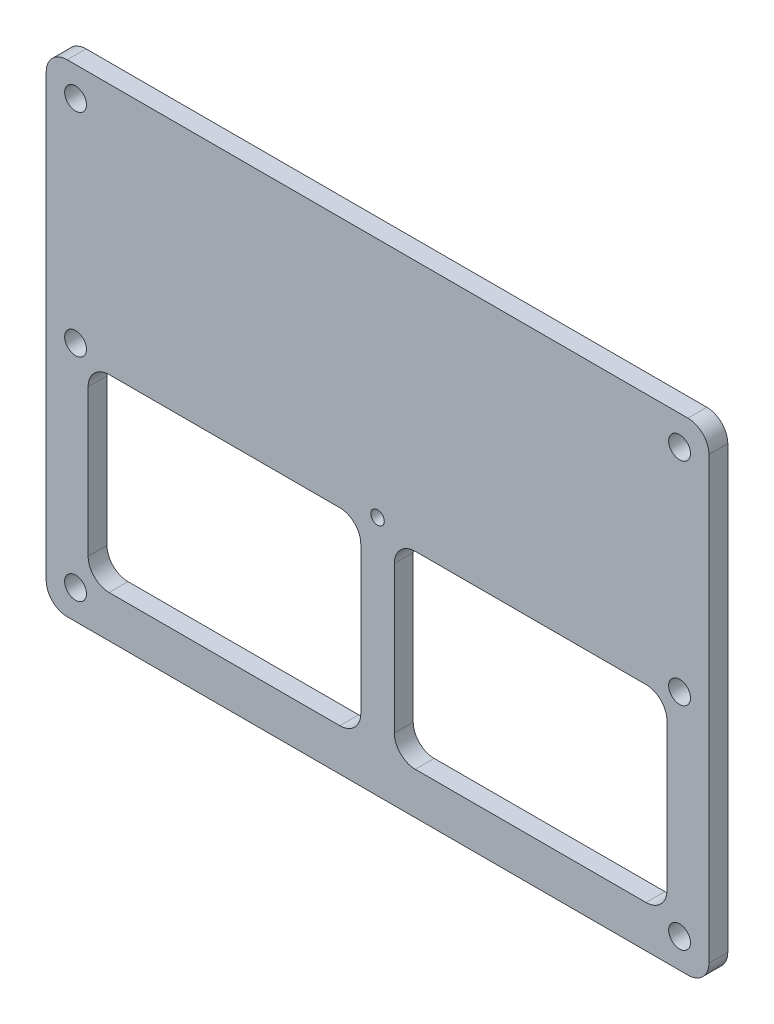
from build123d import *

# Parameters (mm, degrees)
SKETCH_1_W          = 158
SKETCH_1_H          = 115
EXTRUDE_1_DEPTH     = 4.5
SKETCH_2_R          = 2.6
SKETCH_2_R_2        = 1.6
CUT_EXTRUDE_1_DEPTH = 4.5
FILLET_1_R          = 5


with BuildPart() as part:
    # 草图1 → 凸台-拉伸1 (new body)
    with BuildSketch(Plane.XY):
        Rectangle(SKETCH_1_W, SKETCH_1_H)
    extrude(amount=EXTRUDE_1_DEPTH)

    # 草图2 → 切除-拉伸1 (cut)
    with BuildSketch(Plane.XY.offset(4.5)):
        with Locations((-72, 50.5)):
            Circle(SKETCH_2_R)
        with Locations((72, 50.5)):
            Circle(SKETCH_2_R)
        with Locations((72, 0)):
            Circle(SKETCH_2_R)
        with Locations((72, -50.5)):
            Circle(SKETCH_2_R)
        with Locations((-72, -50.5)):
            Circle(SKETCH_2_R)
        with Locations((-72, 0)):
            Circle(SKETCH_2_R)
        Circle(SKETCH_2_R_2)
        with BuildLine():
            Line((4, -7.5), (4, -42.5))
            ThreePointArc((4, -42.5), (5.464466094, -46.035533906), (9, -47.5))
            Line((9, -47.5), (64, -47.5))
            ThreePointArc((64, -47.5), (67.535533906, -46.035533906), (69, -42.5))
            Line((69, -42.5), (69, -7.5))
            ThreePointArc((69, -7.5), (67.535533906, -3.964466094), (64, -2.5))
            Line((64, -2.5), (9, -2.5))
            ThreePointArc((9, -2.5), (5.464466094, -3.964466094), (4, -7.5))
        make_face()
        with BuildLine():
            Line((-64, -2.5), (-9, -2.5))
            ThreePointArc((-9, -2.5), (-5.464466094, -3.964466094), (-4, -7.5))
            Line((-4, -7.5), (-4, -42.5))
            ThreePointArc((-4, -42.5), (-5.464466094, -46.035533906), (-9, -47.5))
            Line((-9, -47.5), (-64, -47.5))
            ThreePointArc((-64, -47.5), (-67.535533906, -46.035533906), (-69, -42.5))
            Line((-69, -42.5), (-69, -7.5))
            ThreePointArc((-69, -7.5), (-67.535533906, -3.964466094), (-64, -2.5))
        make_face()
    extrude(amount=-CUT_EXTRUDE_1_DEPTH, mode=Mode.SUBTRACT)

    # 圆角1
    fillet_1_edges = [part.edges().sort_by_distance(p)[0] for p in [
        (-79, 57.5, 2.25),
        (79, 57.5, 2.25),
        (79, -57.5, 2.25),
        (-79, -57.5, 2.25),
    ]]
    fillet(fillet_1_edges, radius=FILLET_1_R)


solid = part.part
